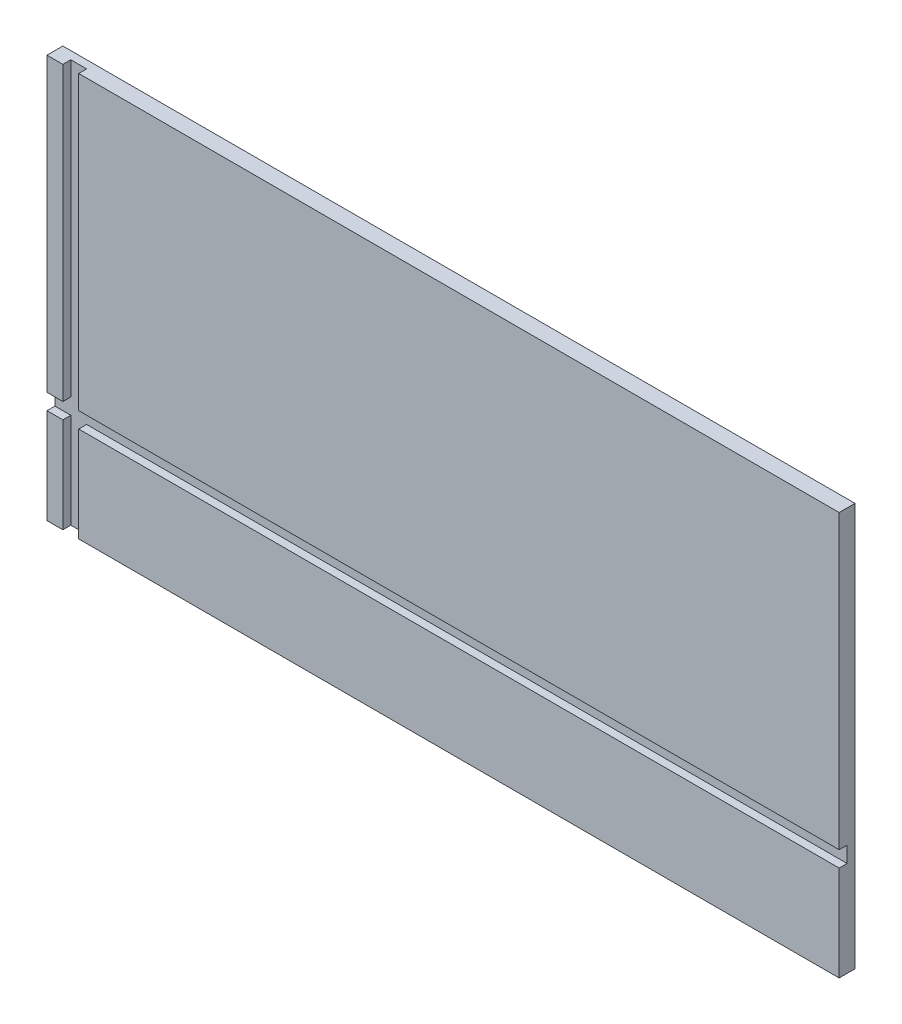
from build123d import *

# Parameters (mm, degrees)
BOSS_EXTRUDE1_DEPTH = 3.175
SKETCH2_W           = 1.5875
SKETCH2_H           = 3.175
CUT_EXTRUDE1_DEPTH  = 170.414546822
BOSS_EXTRUDE2_DEPTH = 9.525
SKETCH5_W           = 3.175
SKETCH5_H           = 80.645
CUT_EXTRUDE2_DEPTH  = 1.5875


with BuildPart() as part:
    # Sketch1 → Boss-Extrude1 (new body)
    with BuildSketch(Plane.XY):
        Polygon((89.265, 0), (148.955, 0), (148.955, 80.645), (0, 80.645), (0, 0), align=None)
    extrude(amount=BOSS_EXTRUDE1_DEPTH)

    # Sketch2 → Cut-Extrude1 (cut, through all)
    with BuildSketch(Plane(origin=(148.955, 0, 0), x_dir=(0, 0, -1), z_dir=(1, 0, 0))):
        with Locations((-2.38125, 20.6375)):
            Rectangle(SKETCH2_W, SKETCH2_H)
    extrude(amount=-CUT_EXTRUDE1_DEPTH, mode=Mode.SUBTRACT)

    # Sketch4 → Boss-Extrude2 (add)
    with BuildSketch(Plane.ZY):
        Polygon((3.175, 19.05), (3.175, 0), (0, 0), (0, 80.645), (3.175, 80.645), (3.175, 22.225), (1.5875, 22.225), (1.5875, 19.05), align=None)
    extrude(amount=BOSS_EXTRUDE2_DEPTH)

    # Sketch5 → Cut-Extrude2 (cut)
    with BuildSketch(Plane.XY.offset(3.175)):
        with Locations((-4.7625, 40.3225)):
            Rectangle(SKETCH5_W, SKETCH5_H)
    extrude(amount=-CUT_EXTRUDE2_DEPTH, mode=Mode.SUBTRACT)


solid = part.part
